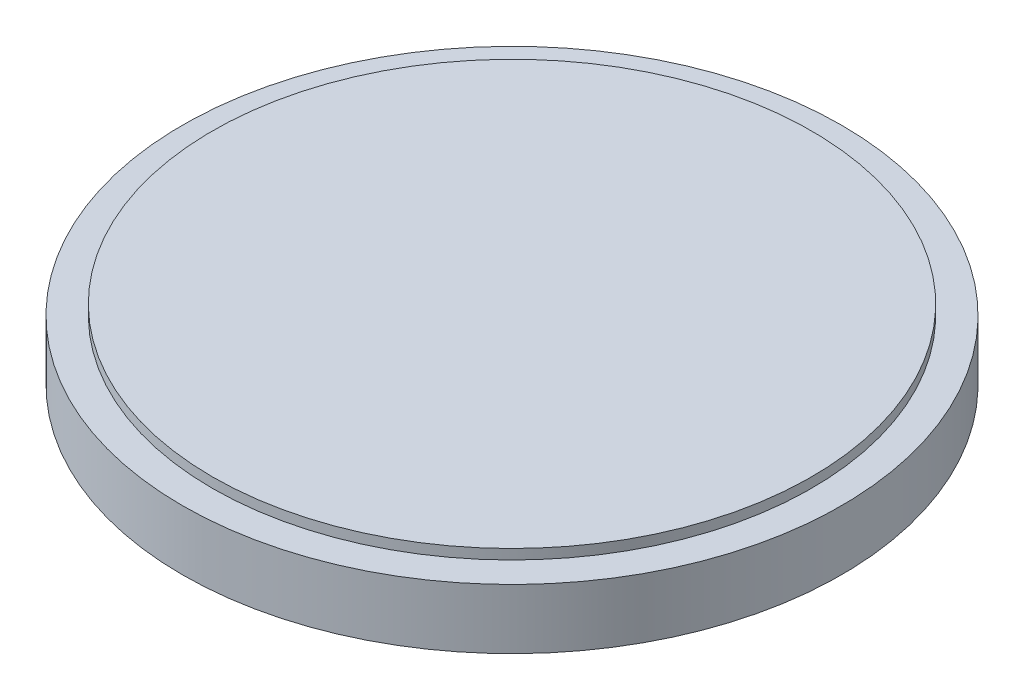
from build123d import *

# Parameters (mm, degrees)
SKETCH1_R           = 33
SKETCH1_R_2         = 29
BEZEL_RING_DEPTH    = 6
SKETCH2_R           = 30
CUT_EXTRUDE1_DEPTH  = 1
SKETCH4_R           = 30
BOSS_EXTRUDE2_DEPTH = 1


with BuildPart() as part:
    # Sketch1 → BEZEL_RING (new body)
    with BuildSketch(Plane(origin=(0, 0, 0), x_dir=(1, 0, 0), z_dir=(0, 1, 0))):
        with Locations(Location((0, 0, 0), (0, 0, 270))):
            Circle(SKETCH1_R)
        with Locations(Location((0, 0, 0), (0, 0, 270))):
            Circle(SKETCH1_R_2, mode=Mode.SUBTRACT)
    extrude(amount=BEZEL_RING_DEPTH)

    # Sketch2 → Cut-Extrude1 (cut)
    with BuildSketch(Plane(origin=(0, 0, 0), x_dir=(1, 0, 0), z_dir=(0, 1, 0))):
        with Locations(Location((0, 0, 0), (0, 0, 270))):
            Circle(SKETCH2_R)
    extrude(amount=CUT_EXTRUDE1_DEPTH, mode=Mode.SUBTRACT)


with BuildPart() as body_2:
    # Sketch4 → Boss-Extrude2 (new body)
    with BuildSketch(Plane(origin=(0, 6, 0), x_dir=(1, 0, 0), z_dir=(0, 1, 0))):
        with Locations(Location((0, 0, 0), (0, 0, 270))):
            Circle(SKETCH4_R)
    extrude(amount=BOSS_EXTRUDE2_DEPTH)


solid = Compound([part.part, body_2.part])
